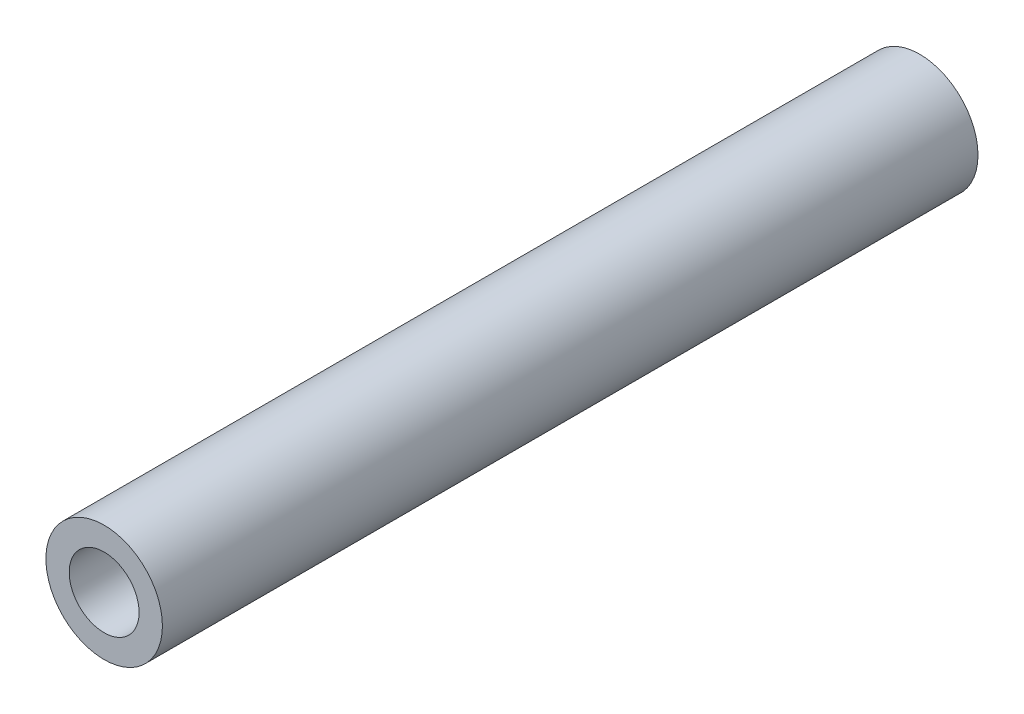
from build123d import *

# Parameters (mm, degrees)
INSTALLED_SPRING_PIN_START = -7
SKETCH1_R                  = 1
SKETCH1_R_2                = 0.6
INSTALLED_SPRING_PIN_DEPTH = 14


with BuildPart() as part:
    # Sketch1 → Installed_Spring_Pin (new body)
    with BuildSketch(Plane.XY.offset(INSTALLED_SPRING_PIN_START)):
        Circle(SKETCH1_R)
        Circle(SKETCH1_R_2, mode=Mode.SUBTRACT)
    extrude(amount=INSTALLED_SPRING_PIN_DEPTH)


solid = part.part
